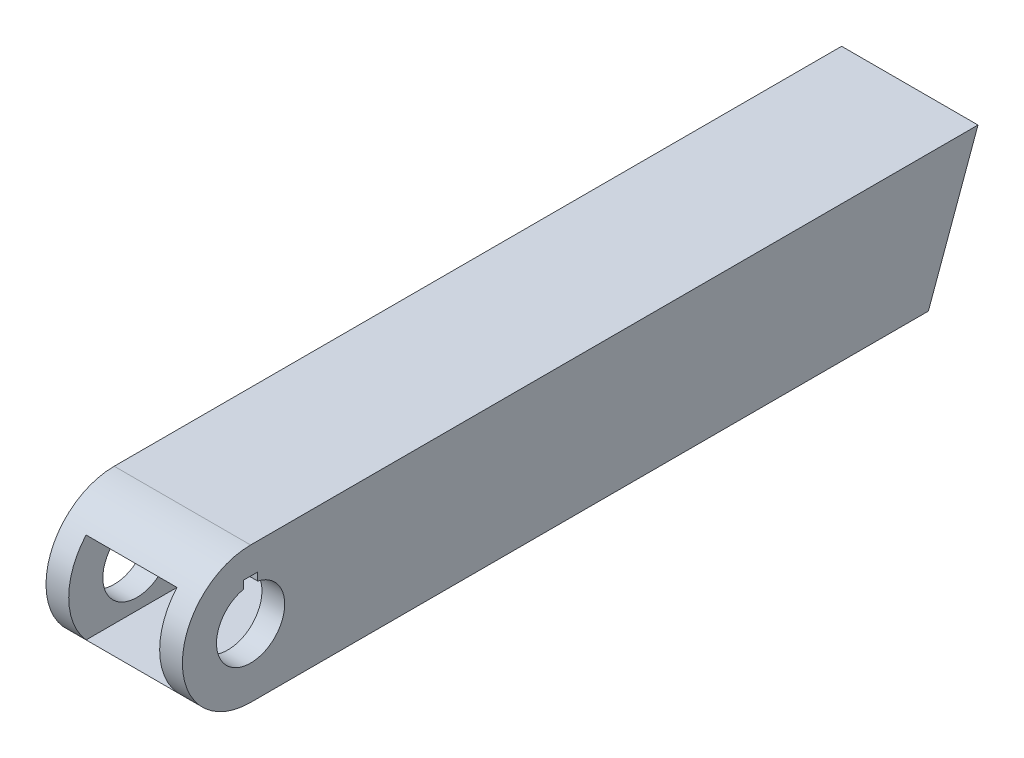
from build123d import *

# Parameters (mm, degrees)
BOSS_EXTRUDE1_DEPTH = 19.05
SKETCH2_W           = 12.7
SKETCH2_H           = 12.7
CUT_EXTRUDE3_DEPTH  = 106.732743864
SKETCH3_W           = 19.05
SKETCH3_H           = 19.05
SKETCH3_W_2         = 12.7
SKETCH3_H_2         = 12.7
BOSS_EXTRUDE2_DEPTH = 12.7
CUT_EXTRUDE5_DEPTH  = 19.05


with BuildPart() as part:
    # Sketch1 → Boss-Extrude1 (new body)
    with BuildSketch(Plane(origin=(0, 0, 0), x_dir=(0, 0, -1), z_dir=(1, 0, 0))):
        Polygon((-12.7, 22.225), (81.966367037, 22.225), (88.9, 22.225), (81.966367037, 3.175), (-12.7, 3.175), align=None)
    extrude(amount=BOSS_EXTRUDE1_DEPTH)

    # Sketch2 → Cut-Extrude3 (cut, through all)
    with BuildSketch(Plane.XY.offset(12.7)):
        with Locations((9.525, 12.7)):
            Rectangle(SKETCH2_W, SKETCH2_H)
    extrude(amount=-CUT_EXTRUDE3_DEPTH, mode=Mode.SUBTRACT)

    # Sketch3 → Boss-Extrude2 (add)
    with BuildSketch(Plane.XY.offset(12.7)):
        with Locations((9.525, 12.7)):
            Rectangle(SKETCH3_W, SKETCH3_H)
        with Locations((9.525, 12.7)):
            Rectangle(SKETCH3_W_2, SKETCH3_H_2, mode=Mode.SUBTRACT)
    extrude(amount=BOSS_EXTRUDE2_DEPTH)

    # Sketch4 → Cut-Extrude5 (cut)
    with BuildSketch(Plane(origin=(19.05, 0, 0), x_dir=(0, 0, -1), z_dir=(1, 0, 0))):
        with BuildLine():
            Line((-11.7, 17.356329697), (-11.7, 16.4625))
            Line((-11.7, 16.4625), (-13.7, 16.4625))
            Line((-13.7, 16.4625), (-13.7, 17.356329697))
            ThreePointArc((-13.7, 17.356329697), (-15.693234559, 8.995684527), (-7.9375, 12.7))
            ThreePointArc((-7.9375, 12.7), (-8.995684527, 15.693234559), (-11.7, 17.356329697))
        make_face()
        with BuildLine():
            Line((-13.7, 16.4625), (-11.7, 16.4625))
            Line((-11.7, 16.4625), (-11.7, 17.356329697))
            ThreePointArc((-11.7, 17.356329697), (-12.7, 17.4625), (-13.7, 17.356329697))
            Line((-13.7, 17.356329697), (-13.7, 16.4625))
        make_face()
        with BuildLine():
            ThreePointArc((-13.7, 17.356329697), (-12.7, 17.4625), (-11.7, 17.356329697))
            Line((-11.7, 17.356329697), (-11.7, 18.4625))
            Line((-11.7, 18.4625), (-13.7, 18.4625))
            Line((-13.7, 18.4625), (-13.7, 17.356329697))
        make_face()
        with BuildLine():
            Line((-25.4, 3.175), (-12.7, 3.175))
            ThreePointArc((-12.7, 3.175), (-22.225, 12.7), (-12.7, 22.225))
            Line((-12.7, 22.225), (-25.4, 22.225))
            Line((-25.4, 22.225), (-25.4, 3.175))
        make_face()
    extrude(amount=-CUT_EXTRUDE5_DEPTH, mode=Mode.SUBTRACT)


solid = part.part
